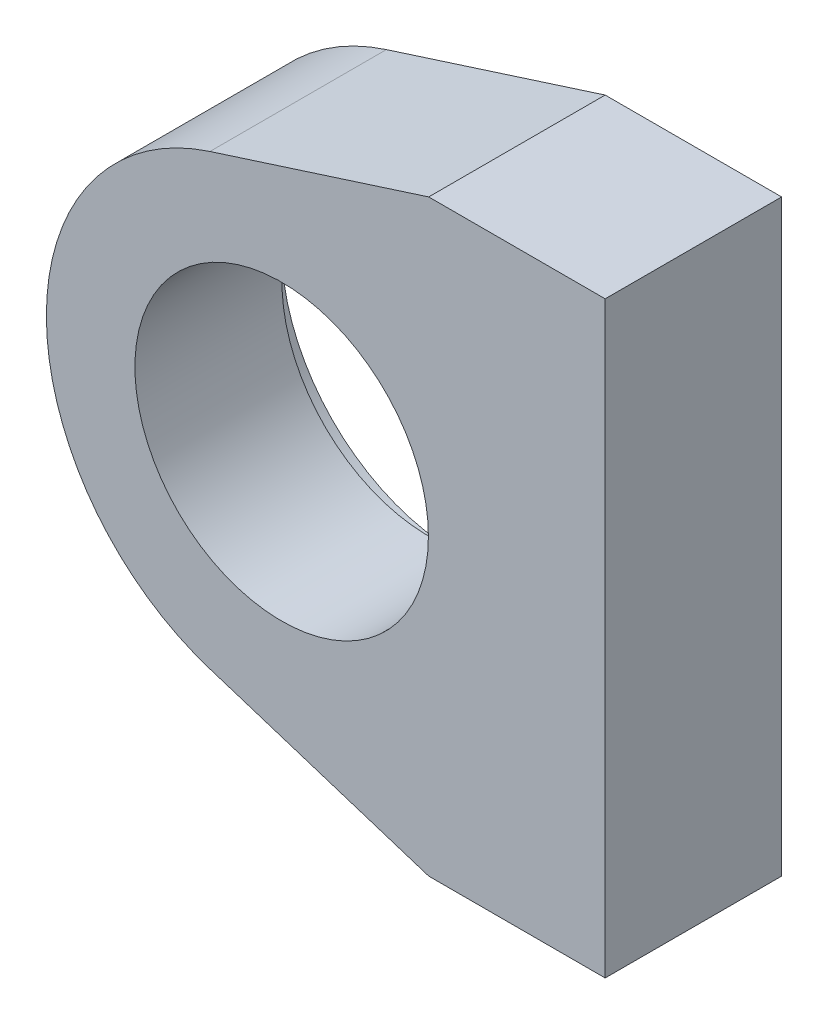
from build123d import *

# Parameters (mm, degrees)
SKETCH1_R           = 4
BOSS_EXTRUDE1_DEPTH = 6
CUT_EXTRUDE1_REACH  = 18.031
SKETCH4_R           = 4.99
SKETCH6_R           = 6
CUT_EXTRUDE3_DEPTH  = 1


with BuildPart() as part:
    # Sketch1 → Boss-Extrude1 (new body)
    with BuildSketch(Plane.XY):
        with BuildLine():
            Line((-2.438559793, 7.619279896), (5, 10))
            Line((5, 10), (11, 10))
            Line((11, 10), (11, -10))
            Line((11, -10), (5, -10))
            Line((5, -10), (-2.438559793, -7.619279896))
            ThreePointArc((-2.438559793, -7.619279896), (-8, 0), (-2.438559793, 7.619279896))
        make_face()
        Circle(SKETCH1_R, mode=Mode.SUBTRACT)
    extrude(amount=BOSS_EXTRUDE1_DEPTH)

    # Sketch4 → Cut-Extrude1 (cut, up to next)
    with BuildSketch(Plane.XY.offset(6), mode=Mode.PRIVATE) as cut_extrude1_sk1:
        Circle(SKETCH4_R)
    cut_extrude1_tool1 = extrude(cut_extrude1_sk1.sketch, amount=-CUT_EXTRUDE1_REACH, mode=Mode.PRIVATE) & part.part
    add(cut_extrude1_tool1.solids().sort_by_distance((0, 0, 6))[0], mode=Mode.SUBTRACT)

    # Sketch6 → Cut-Extrude3 (cut)
    with BuildSketch(Plane(origin=(0, 0, 0), x_dir=(-1, 0, 0), z_dir=(0, 0, -1))):
        Circle(SKETCH6_R)
    extrude(amount=-CUT_EXTRUDE3_DEPTH, mode=Mode.SUBTRACT)


solid = part.part
